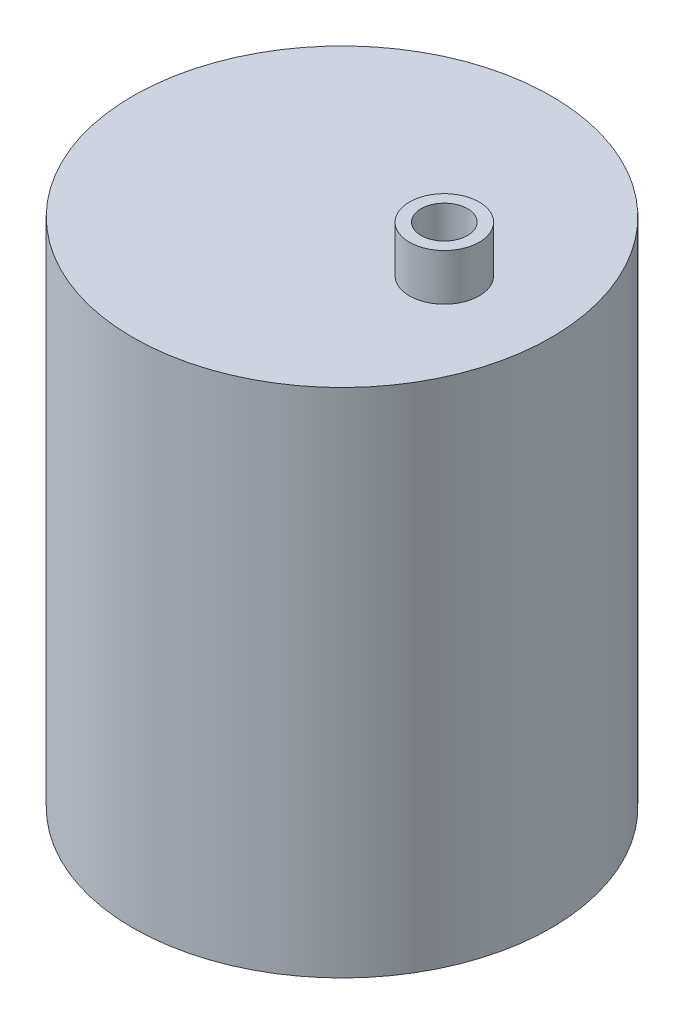
from build123d import *

# Parameters (mm, degrees)
SKETCH1_W           = 35
SKETCH1_H           = 10
BOSS_EXTRUDE1_DEPTH = 70
SKETCH2_3_R         = 7.5
SKETCH2_3_R_2       = 5
BOSS_EXTRUDE2_DEPTH = 10
CUT_EXTRUDE1_START  = -70
SKETCH2_4_R         = 5
CUT_EXTRUDE1_DEPTH  = 70
SKETCH3_R           = 7.5
SKETCH3_R_2         = 5
BOSS_EXTRUDE3_DEPTH = 10
CUT_EXTRUDE3_START  = -10
SKETCH3_2_R         = 5
CUT_EXTRUDE3_DEPTH  = 10
BOSS_EXTRUDE6_START = 6
BOSS_EXTRUDE6_DEPTH = 6


with BuildPart() as part:
    # Sketch1 → Revolve1 (revolve)
    with BuildSketch(Plane(origin=(0, 0, 0), x_dir=(0, 0, -1), z_dir=(1, 0, 0)), mode=Mode.PRIVATE) as revolve1_sk:
        Polygon((35, 79.538461538), (35, 89.538461538), (45, 89.538461538), (45, -20.461538462), (0, -20.461538462), (0, -10.461538462), (0, 49.538461538), (8, 49.538461538), (27, -10.461538462), (35, -10.461538462), align=None)
        with Locations((17.5, 84.538461538)):
            Rectangle(SKETCH1_W, SKETCH1_H)
    revolve(revolve1_sk.sketch.rotate(Axis((0, 0, 0), (0, -1, 0)), 180), axis=Axis((0, 0, 0), (0, -1, 0)))

    # Sketch2 → Boss-Extrude1 (add)
    with BuildSketch(Plane.XZ.offset(20.461538462)):
        with BuildLine():
            Line((40, 5), (10.356157589, 5))
            ThreePointArc((10.356157589, 5), (10.819851722, 3.896255731), (11.166285361, 2.750285665))
            Line((11.166285361, 2.750285665), (22.5, 1))
            Line((22.5, 1), (22.5, -1))
            Line((22.5, -1), (11.166285361, -2.750285665))
            ThreePointArc((11.166285361, -2.750285665), (10.819851722, -3.896255731), (10.356157589, -5))
            Line((10.356157589, -5), (40, -5))
            Line((40, -5), (40, 5))
        make_face()
        with BuildLine():
            ThreePointArc((2.750285665, 11.166285361), (3.896255731, 10.819851722), (5, 10.356157589))
            Line((5, 10.356157589), (5, 40))
            Line((5, 40), (-5, 40))
            Line((-5, 40), (-5, 10.356157589))
            ThreePointArc((-5, 10.356157589), (-3.896255731, 10.819851722), (-2.750285665, 11.166285361))
            Line((-2.750285665, 11.166285361), (-1, 22.5))
            Line((-1, 22.5), (1, 22.5))
            Line((1, 22.5), (2.750285665, 11.166285361))
        make_face()
        with BuildLine():
            Line((5, -40), (5, -10.356157589))
            ThreePointArc((5, -10.356157589), (3.896255731, -10.819851722), (2.750285665, -11.166285361))
            Line((2.750285665, -11.166285361), (1, -22.5))
            Line((1, -22.5), (-1, -22.5))
            Line((-1, -22.5), (-2.750285665, -11.166285361))
            ThreePointArc((-2.750285665, -11.166285361), (-3.896255731, -10.819851722), (-5, -10.356157589))
            Line((-5, -10.356157589), (-5, -40))
            Line((-5, -40), (5, -40))
        make_face()
        with BuildLine():
            ThreePointArc((-11.166285361, 2.750285665), (-10.819851722, 3.896255731), (-10.356157589, 5))
            Line((-10.356157589, 5), (-40, 5))
            Line((-40, 5), (-40, -5))
            Line((-40, -5), (-10.356157589, -5))
            ThreePointArc((-10.356157589, -5), (-10.819851722, -3.896255731), (-11.166285361, -2.750285665))
            Line((-11.166285361, -2.750285665), (-22.5, -1))
            Line((-22.5, -1), (-22.5, 1))
            Line((-22.5, 1), (-11.166285361, 2.750285665))
        make_face()
    extrude(amount=-BOSS_EXTRUDE1_DEPTH)

    # Sketch2<3> → Boss-Extrude2 (add)
    with BuildSketch(Plane.XZ.offset(20.461538462)):
        with Locations(Location((0, 0, 0), (0, 0, 270))):
            Circle(SKETCH2_3_R)
        with Locations(Location((0, 0, 0), (0, 0, 270))):
            Circle(SKETCH2_3_R_2, mode=Mode.SUBTRACT)
    extrude(amount=BOSS_EXTRUDE2_DEPTH)

    # Sketch2<4> → Cut-Extrude1 (cut)
    with BuildSketch(Plane.XZ.offset(20.461538462).offset(CUT_EXTRUDE1_START)):
        with Locations(Location((0, 0, 0), (0, 0, 270))):
            Circle(SKETCH2_4_R)
    extrude(amount=CUT_EXTRUDE1_DEPTH, mode=Mode.SUBTRACT)

    # Sketch3 → Boss-Extrude3 (add)
    with BuildSketch(Plane(origin=(0, 89.538461538, 0), x_dir=(1, 0, 0), z_dir=(0, 1, 0))):
        with Locations(Location((22, 0, 0), (0, 0, 270))):
            Circle(SKETCH3_R)
        with Locations(Location((22, 0, 0), (0, 0, 270))):
            Circle(SKETCH3_R_2, mode=Mode.SUBTRACT)
    extrude(amount=BOSS_EXTRUDE3_DEPTH)

    # Sketch3<2> → Cut-Extrude3 (cut)
    with BuildSketch(Plane(origin=(0, 89.538461538, 0), x_dir=(1, 0, 0), z_dir=(0, 1, 0)).offset(CUT_EXTRUDE3_START)):
        with Locations(Location((22, 0, 0), (0, 0, 270))):
            Circle(SKETCH3_2_R)
    extrude(amount=CUT_EXTRUDE3_DEPTH, mode=Mode.SUBTRACT)

    # Sketch2<5> → Boss-Extrude6 (add)
    with BuildSketch(Plane.XZ.offset(20.461538462).offset(BOSS_EXTRUDE6_START)):
        with BuildLine():
            ThreePointArc((-9.840501743, 5.951010455), (-8.131727984, 8.131727984), (-5.951010455, 9.840501743))
            Line((-5.951010455, 9.840501743), (-15.202795796, 16.617009358))
            Line((-15.202795796, 16.617009358), (-15.909902577, 15.909902577))
            Line((-15.909902577, 15.909902577), (-16.617009358, 15.202795796))
            Line((-16.617009358, 15.202795796), (-9.840501743, 5.951010455))
        make_face()
        with BuildLine():
            ThreePointArc((-2.750285665, 11.166285361), (0, 11.5), (2.750285665, 11.166285361))
            Line((2.750285665, 11.166285361), (1, 22.5))
            Line((1, 22.5), (0, 22.5))
            Line((0, 22.5), (-1, 22.5))
            Line((-1, 22.5), (-2.750285665, 11.166285361))
        make_face()
        with BuildLine():
            ThreePointArc((5.951010455, 9.840501743), (8.131727984, 8.131727984), (9.840501743, 5.951010455))
            Line((9.840501743, 5.951010455), (16.617009358, 15.202795796))
            Line((16.617009358, 15.202795796), (15.909902577, 15.909902577))
            Line((15.909902577, 15.909902577), (15.202795796, 16.617009358))
            Line((15.202795796, 16.617009358), (5.951010455, 9.840501743))
        make_face()
        with BuildLine():
            Line((22.5, 1), (11.166285361, 2.750285665))
            ThreePointArc((11.166285361, 2.750285665), (11.416266501, 1.385228925), (11.5, 0))
            ThreePointArc((11.5, 0), (11.416266501, -1.385228925), (11.166285361, -2.750285665))
            Line((11.166285361, -2.750285665), (22.5, -1))
            Line((22.5, -1), (22.5, 0))
            Line((22.5, 0), (22.5, 1))
        make_face()
        with BuildLine():
            Line((16.617009358, -15.202795796), (9.840501743, -5.951010455))
            ThreePointArc((9.840501743, -5.951010455), (8.131727984, -8.131727984), (5.951010455, -9.840501743))
            Line((5.951010455, -9.840501743), (15.202795796, -16.617009358))
            Line((15.202795796, -16.617009358), (15.909902577, -15.909902577))
            Line((15.909902577, -15.909902577), (16.617009358, -15.202795796))
        make_face()
        with BuildLine():
            Line((1, -22.5), (2.750285665, -11.166285361))
            ThreePointArc((2.750285665, -11.166285361), (0, -11.5), (-2.750285665, -11.166285361))
            Line((-2.750285665, -11.166285361), (-1, -22.5))
            Line((-1, -22.5), (0, -22.5))
            Line((0, -22.5), (1, -22.5))
        make_face()
        with BuildLine():
            Line((-15.202795796, -16.617009358), (-5.951010455, -9.840501743))
            ThreePointArc((-5.951010455, -9.840501743), (-8.131727984, -8.131727984), (-9.840501743, -5.951010455))
            Line((-9.840501743, -5.951010455), (-16.617009358, -15.202795796))
            Line((-16.617009358, -15.202795796), (-15.909902577, -15.909902577))
            Line((-15.909902577, -15.909902577), (-15.202795796, -16.617009358))
        make_face()
        with BuildLine():
            ThreePointArc((-11.166285361, -2.750285665), (-11.5, 0), (-11.166285361, 2.750285665))
            Line((-11.166285361, 2.750285665), (-22.5, 1))
            Line((-22.5, 1), (-22.5, 0))
            Line((-22.5, 0), (-22.5, -1))
            Line((-22.5, -1), (-11.166285361, -2.750285665))
        make_face()
    extrude(amount=-BOSS_EXTRUDE6_DEPTH)


solid = part.part
